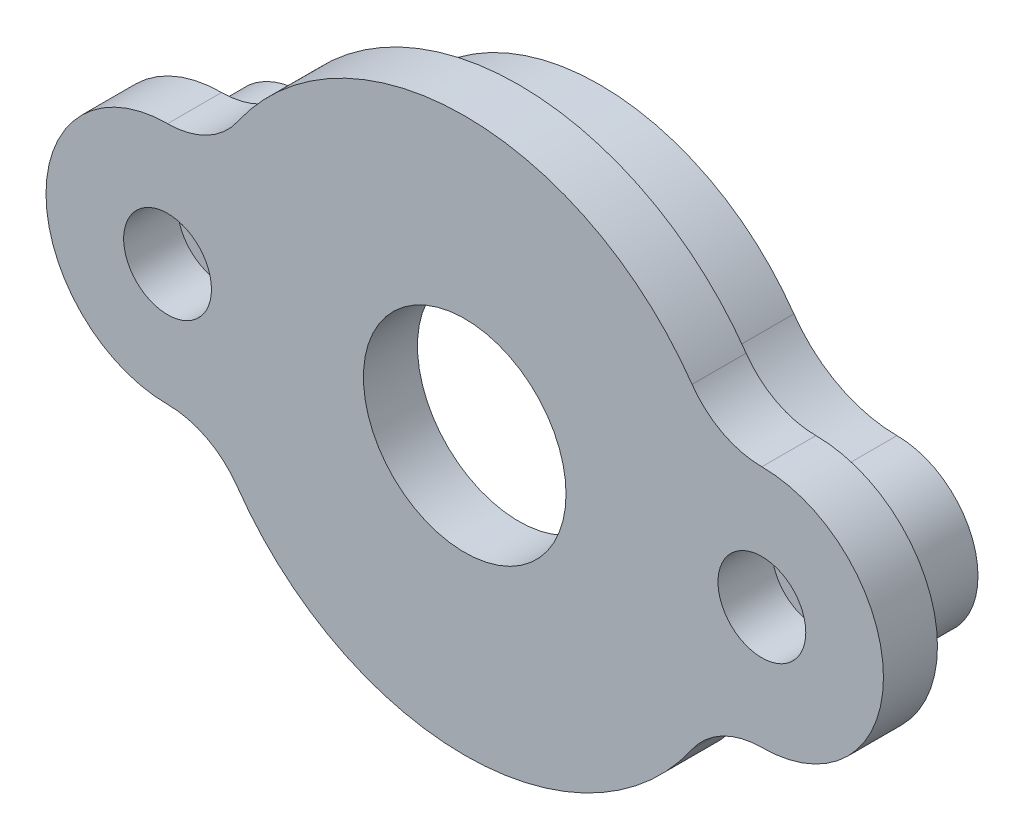
from build123d import *

# Parameters (mm, degrees)
BOSS_EXTRUDE1_DEPTH = 10
SKETCH1_3_R         = 16
SKETCH1_3_R_2       = 7.5
CUT_EXTRUDE1_DEPTH  = 6
SKETCH1_4_R         = 7.5
CUT_EXTRUDE2_DEPTH  = 10
CUT_EXTRUDE3_DEPTH  = 6
SKETCH3_R           = 1.75
CUT_EXTRUDE4_DEPTH  = 10
SKETCH4_R           = 3.25
CUT_EXTRUDE5_DEPTH  = 4


with BuildPart() as part:
    # Sketch1 → Boss-Extrude1 (new body)
    with BuildSketch(Plane.XY):
        with BuildLine():
            ThreePointArc((-16.832454361, 11.701217039), (-19.084519704, 9.716037695), (-22, 9))
            ThreePointArc((-22, 9), (-31, 0), (-22, -9))
            ThreePointArc((-22, -9), (-19.084519704, -9.716037695), (-16.832454361, -11.701217039))
            ThreePointArc((-16.832454361, -11.701217039), (0, -20.5), (16.832454361, -11.701217039))
            ThreePointArc((16.832454361, -11.701217039), (19.084519704, -9.716037695), (22, -9))
            ThreePointArc((22, -9), (31, 0), (22, 9))
            ThreePointArc((22, 9), (19.084519704, 9.716037695), (16.832454361, 11.701217039))
            ThreePointArc((16.832454361, 11.701217039), (0, 20.5), (-16.832454361, 11.701217039))
        make_face()
    extrude(amount=BOSS_EXTRUDE1_DEPTH)

    # Sketch1<3> → Cut-Extrude1 (cut)
    with BuildSketch(Plane.XY):
        Circle(SKETCH1_3_R)
        Circle(SKETCH1_3_R_2, mode=Mode.SUBTRACT)
    extrude(amount=CUT_EXTRUDE1_DEPTH, mode=Mode.SUBTRACT)

    # Sketch1<4> → Cut-Extrude2 (cut)
    with BuildSketch(Plane.XY):
        Circle(SKETCH1_4_R)
    extrude(amount=CUT_EXTRUDE2_DEPTH, mode=Mode.SUBTRACT)

    # Sketch1<5> → Cut-Extrude3 (cut)
    with BuildSketch(Plane.XY):
        with BuildLine():
            ThreePointArc((-16.832454361, 11.701217039), (-19.084519704, 9.716037695), (-22, 9))
            ThreePointArc((-22, 9), (-31, 0), (-22, -9))
            ThreePointArc((-22, -9), (-19.084519704, -9.716037695), (-16.832454361, -11.701217039))
            ThreePointArc((-16.832454361, -11.701217039), (0, -20.5), (16.832454361, -11.701217039))
            ThreePointArc((16.832454361, -11.701217039), (19.084519704, -9.716037695), (22, -9))
            ThreePointArc((22, -9), (31, 0), (22, 9))
            ThreePointArc((22, 9), (19.084519704, 9.716037695), (16.832454361, 11.701217039))
            ThreePointArc((16.832454361, 11.701217039), (0, 20.5), (-16.832454361, 11.701217039))
        make_face()
        with BuildLine():
            ThreePointArc((-22, -6), (-28, 0), (-22, 6))
            ThreePointArc((-22, 6), (-17.694757076, 7.057361363), (-14.369168357, 9.988843813))
            ThreePointArc((-14.369168357, 9.988843813), (0, 17.5), (14.369168357, 9.988843813))
            ThreePointArc((14.369168357, 9.988843813), (17.694757076, 7.057361363), (22, 6))
            ThreePointArc((22, 6), (28, 0), (22, -6))
            ThreePointArc((22, -6), (17.694757076, -7.057361363), (14.369168357, -9.988843813))
            ThreePointArc((14.369168357, -9.988843813), (0, -17.5), (-14.369168357, -9.988843813))
            ThreePointArc((-14.369168357, -9.988843813), (-17.694757076, -7.057361363), (-22, -6))
        make_face(mode=Mode.SUBTRACT)
    extrude(amount=CUT_EXTRUDE3_DEPTH, mode=Mode.SUBTRACT)

    # Sketch3 → Cut-Extrude4 (cut)
    with BuildSketch(Plane.XY.offset(10)):
        with Locations((22, 0)):
            Circle(SKETCH3_R)
        with Locations((-22, 0)):
            Circle(SKETCH3_R)
    extrude(amount=-CUT_EXTRUDE4_DEPTH, mode=Mode.SUBTRACT)

    # Sketch4 → Cut-Extrude5 (cut)
    with BuildSketch(Plane.XY.offset(10)):
        with Locations((22, 0)):
            Circle(SKETCH4_R)
        with Locations((-22, 0)):
            Circle(SKETCH4_R)
    extrude(amount=-CUT_EXTRUDE5_DEPTH, mode=Mode.SUBTRACT)


solid = part.part
